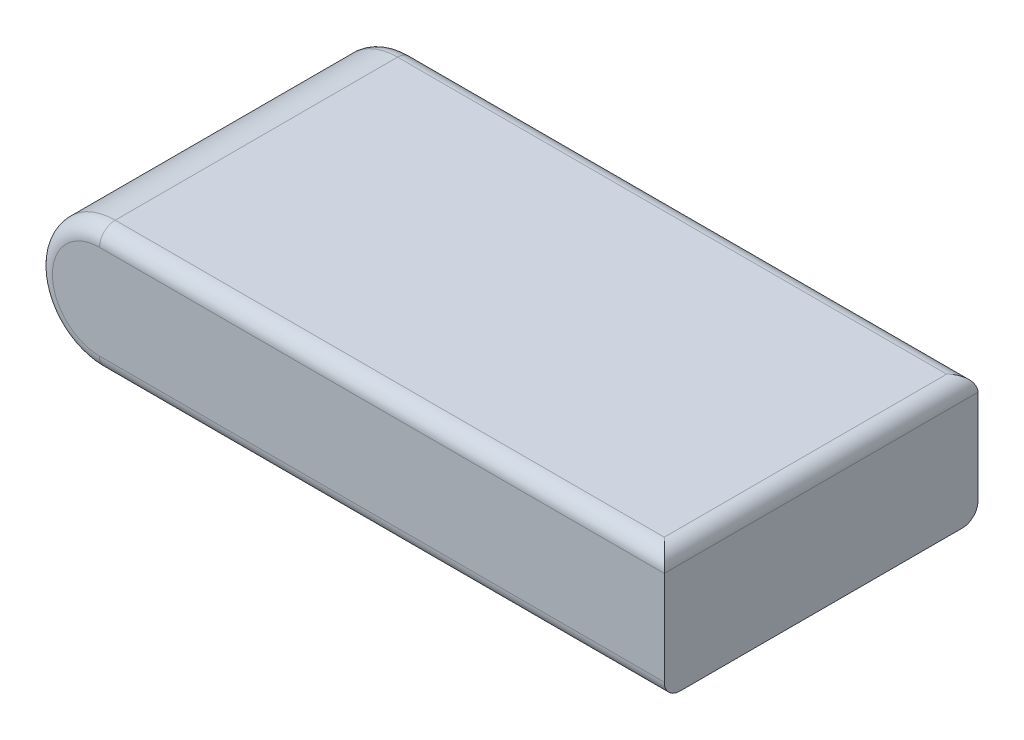
from build123d import *

# Parameters (mm, degrees)
EXTRUDE_1_DEPTH = 20
FILLET_1_R      = 1


with BuildPart() as part:
    # Эскиз1 → Бобышка-Вытянуть1 (new body)
    with BuildSketch(Plane.XY):
        with BuildLine():
            Line((18, -4), (-18, -4))
            ThreePointArc((-18, -4), (-22, 0), (-18, 4))
            Line((-18, 4), (18, 4))
            Line((18, 4), (18, -4))
        make_face()
    extrude(amount=EXTRUDE_1_DEPTH)

    # Скругление1
    fillet_1_edges = [part.edges().sort_by_distance(p)[0] for p in [
        (0, 4, 20),
        (-22, 0, 20),
        (0, 4, 0),
        (0, -4, 0),
        (-22, 0, 0),
        (18, 4, 10),
        (0, -4, 20),
    ]]
    fillet(fillet_1_edges, radius=FILLET_1_R)


solid = part.part
